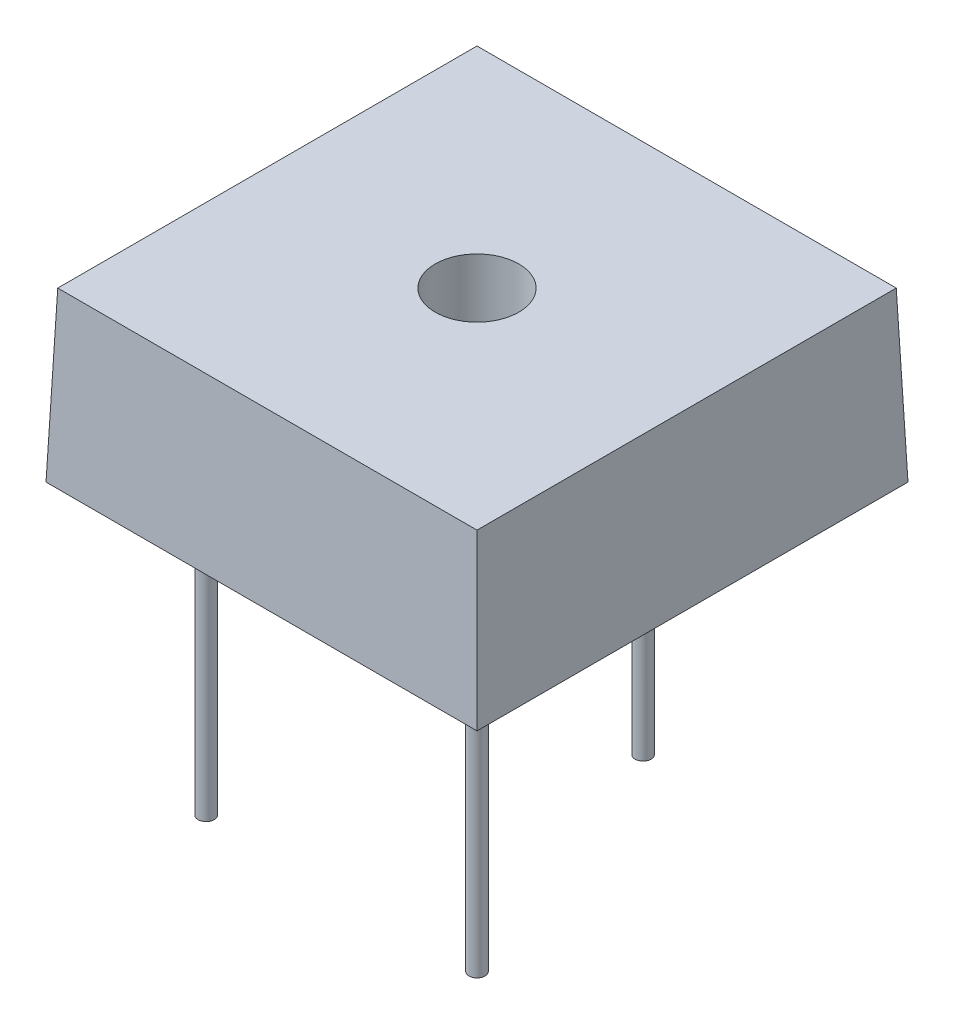
from build123d import *

# Parameters (mm, degrees)
SKETCH1_W           = 28.8
SKETCH1_H           = 28.8
BOSS_EXTRUDE1_DEPTH = 11.23
BOSS_EXTRUDE1_TAPER = 2
SKETCH2_W           = 26.8
SKETCH2_H           = 26.8
SKETCH2_R           = 3.795
CUT_EXTRUDE1_DEPTH  = 0.5
SKETCH3_R           = 2.795
CUT_EXTRUDE2_DEPTH  = 24.255814499
BOSS_EXTRUDE2_START = -10.73
SKETCH4_R           = 0.535
BOSS_EXTRUDE2_DEPTH = 30.5


with BuildPart() as part:
    # Sketch1 → Boss-Extrude1 (new body)
    with BuildSketch(Plane(origin=(0, 0, 0), x_dir=(1, 0, 0), z_dir=(0, 1, 0))):
        Rectangle(SKETCH1_W, SKETCH1_H)
    extrude(amount=BOSS_EXTRUDE1_DEPTH, taper=BOSS_EXTRUDE1_TAPER)

    # Sketch2 → Cut-Extrude1 (cut)
    with BuildSketch(Plane.XZ):
        Rectangle(SKETCH2_W, SKETCH2_H)
        with Locations(Location((0, 0, 0), (0, 0, 270))):
            Circle(SKETCH2_R, mode=Mode.SUBTRACT)
    extrude(amount=-CUT_EXTRUDE1_DEPTH, mode=Mode.SUBTRACT)

    # Sketch3 → Cut-Extrude2 (cut, through all)
    with BuildSketch(Plane.XZ):
        with Locations(Location((0, 0, 0), (0, 0, 270))):
            Circle(SKETCH3_R)
    extrude(amount=-CUT_EXTRUDE2_DEPTH, mode=Mode.SUBTRACT)

    # Sketch4 → Boss-Extrude2 (add)
    with BuildSketch(Plane.XZ.offset(-0.5).offset(BOSS_EXTRUDE2_START)):
        with Locations(Location((-9.05, 9.05, 0), (0, 0, 90))):
            Circle(SKETCH4_R)
        with Locations(Location((9.05, 9.05, 0), (0, 0, 90))):
            Circle(SKETCH4_R)
        with Locations(Location((-9.05, -9.05, 0), (0, 0, 90))):
            Circle(SKETCH4_R)
        with Locations(Location((2.05, -9.05, 0), (0, 0, 90))):
            Circle(SKETCH4_R)
    extrude(amount=BOSS_EXTRUDE2_DEPTH)


solid = part.part
